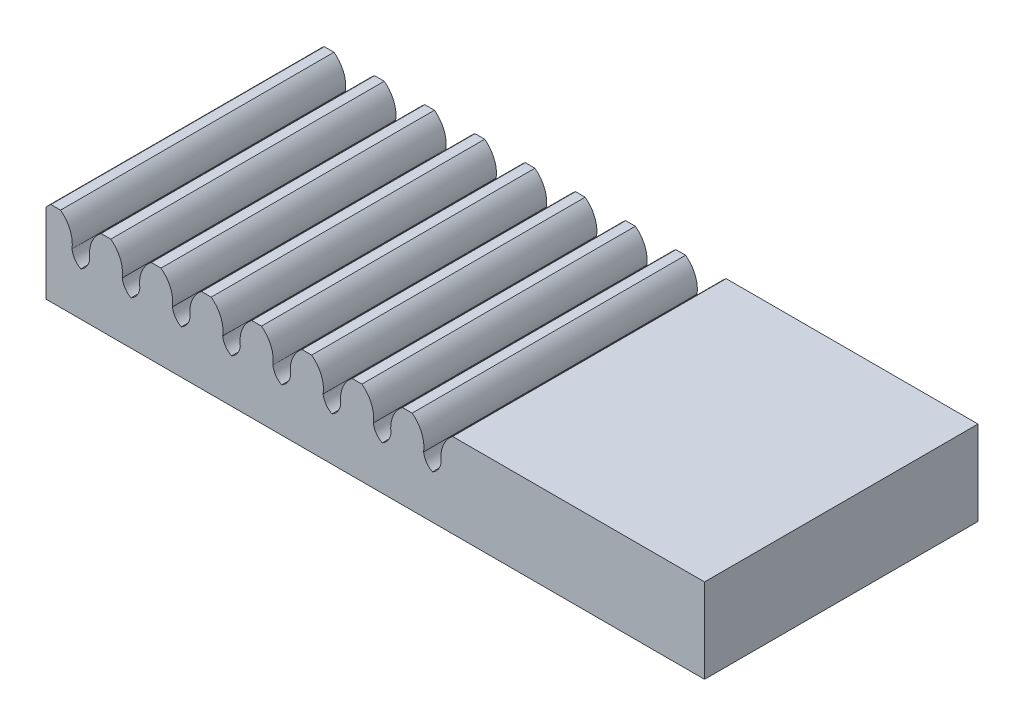
from build123d import *

# Parameters (mm, degrees)
BOSS_EXTRUDE1_DEPTH = 24.5
CUT_EXTRUDE1_DEPTH  = 26.12
LPATTERN1_COUNT     = 4
LPATTERN1_PITCH     = 4.5
LPATTERN1_COL_COUNT = 6
LPATTERN1_COL_PITCH = 4.5


with BuildPart() as part:
    # Sketch1 → Boss-Extrude1 (new body)
    with BuildSketch(Plane.XY):
        Polygon((4, 7), (-19, 7), (-19, -0.560353425), (0.939234275, -0.560353425), (40, -0.560353425), (40, 7), align=None)
    extrude(amount=BOSS_EXTRUDE1_DEPTH)

    # Sketch2 → Cut-Extrude1 (cut)
    with BuildSketch(Plane.XY):
        with BuildLine():
            ThreePointArc((-6.881285782, 3.348371163), (-7.417069895, 3.826658598), (-7.671285782, 4.498371163))
            ThreePointArc((-7.671285782, 4.498371163), (-7.912320341, 6.04482582), (-8.981285782, 7.188037328))
            ThreePointArc((-8.981285782, 7.188037328), (-6.881285782, 7.762283268), (-4.781285782, 7.188037328))
            ThreePointArc((-4.781285782, 7.188037328), (-5.850251222, 6.04482582), (-6.091285782, 4.498371163))
            ThreePointArc((-6.091285782, 4.498371163), (-6.345501668, 3.826658598), (-6.881285782, 3.348371163))
        make_face()
    cut_extrude1 = extrude(amount=CUT_EXTRUDE1_DEPTH, mode=Mode.SUBTRACT)

    # LPattern1: Cut-Extrude1 ×4
    with Locations(*[(-i * LPATTERN1_PITCH, 0, 0) for i in range(1, LPATTERN1_COUNT)]):
        add(cut_extrude1, mode=Mode.SUBTRACT)

    # LPattern1 col: Cut-Extrude1 ×6
    with Locations(*[(i * LPATTERN1_COL_PITCH, 0, 0) for i in range(1, LPATTERN1_COL_COUNT)]):
        add(cut_extrude1, mode=Mode.SUBTRACT)


solid = part.part
